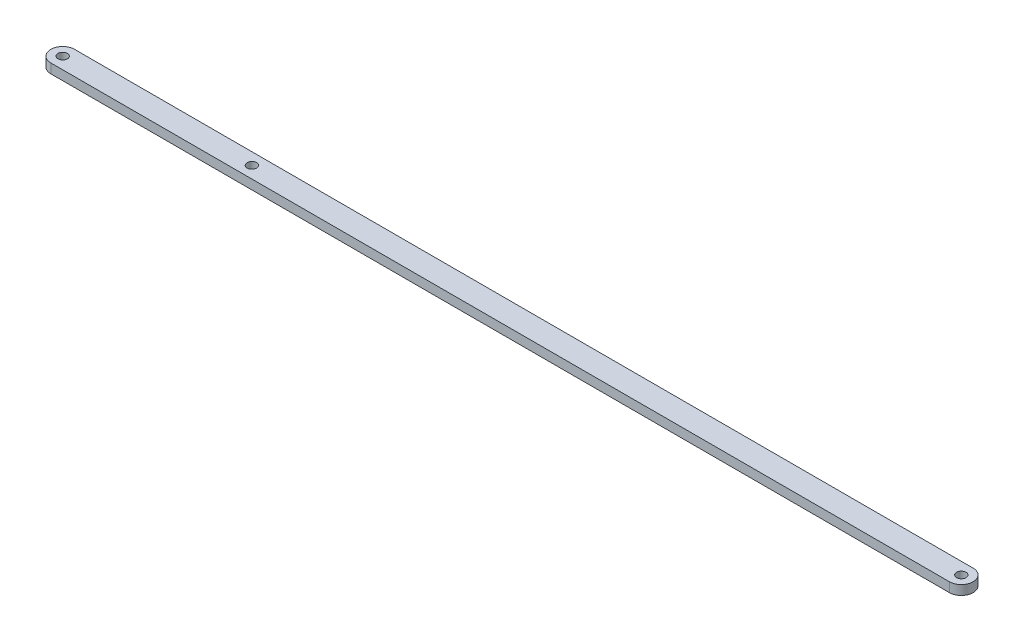
from build123d import *

# Parameters (mm, degrees)
SKETCH1_R           = 1
BOSS_EXTRUDE1_DEPTH = 2
SKETCH2_R           = 1
CUT_EXTRUDE1_DEPTH  = 183.528080032


with BuildPart() as part:
    # Sketch1 → Boss-Extrude1 (new body)
    with BuildSketch(Plane(origin=(0, 0, 0), x_dir=(1, 0, 0), z_dir=(0, 1, 0))):
        with BuildLine():
            Line((-10, 2.5), (180, 2.5))
            ThreePointArc((180, 2.5), (182.5, 0), (180, -2.5))
            Line((180, -2.5), (-10, -2.5))
            ThreePointArc((-10, -2.5), (-12.5, 0), (-10, 2.5))
        make_face()
        with Locations(Location((180, 0, 0), (0, 0, 270))):
            Circle(SKETCH1_R, mode=Mode.SUBTRACT)
        with Locations(Location((-10, 0, 0), (0, 0, 270))):
            Circle(SKETCH1_R, mode=Mode.SUBTRACT)
    extrude(amount=BOSS_EXTRUDE1_DEPTH)

    # Sketch2 → Cut-Extrude1 (cut, through all)
    with BuildSketch(Plane(origin=(0, 2, 0), x_dir=(1, 0, 0), z_dir=(0, 1, 0))):
        with Locations(Location((30, 0, 0), (0, 0, 270))):
            Circle(SKETCH2_R)
    extrude(amount=-CUT_EXTRUDE1_DEPTH, mode=Mode.SUBTRACT)


solid = part.part
